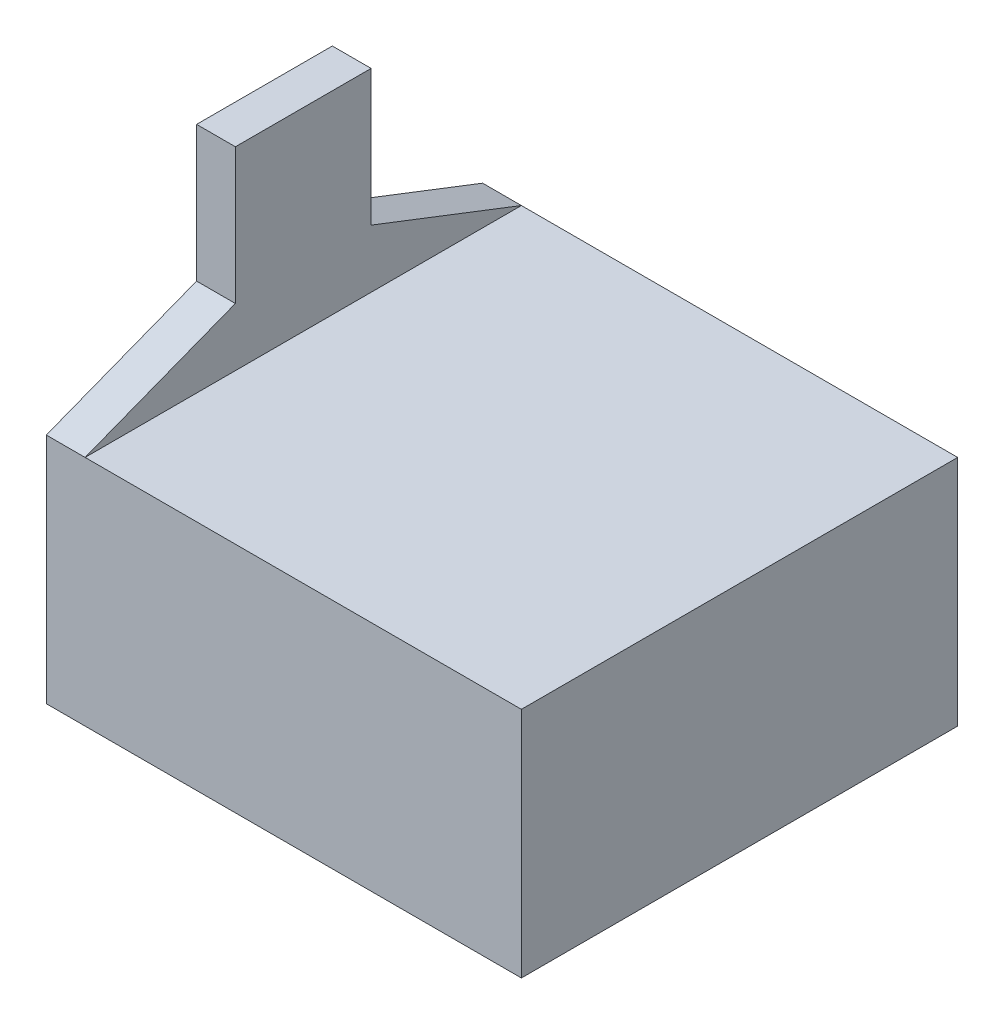
from build123d import *

# Parameters (mm, degrees)
BOSS_EXTRUDE1_DEPTH = 2
SKETCH2_W           = 22.5
SKETCH2_H           = 12
BOSS_EXTRUDE2_DEPTH = 22.5


with BuildPart() as part:
    # Sketch1 → Boss-Extrude1 (new body)
    with BuildSketch(Plane(origin=(0, 0, 0), x_dir=(0, 0, -1), z_dir=(1, 0, 0))):
        Polygon((-11.25, 0), (11.25, 0), (11.25, 12), (3.5, 15), (3.5, 22), (-3.5, 22), (-3.5, 15), (-11.25, 12), align=None)
    extrude(amount=BOSS_EXTRUDE1_DEPTH)

    # Sketch2 → Boss-Extrude2 (add)
    with BuildSketch(Plane(origin=(2, 0, 0), x_dir=(0, 0, -1), z_dir=(1, 0, 0))):
        with Locations((0, 6)):
            Rectangle(SKETCH2_W, SKETCH2_H)
    extrude(amount=BOSS_EXTRUDE2_DEPTH)


solid = part.part
